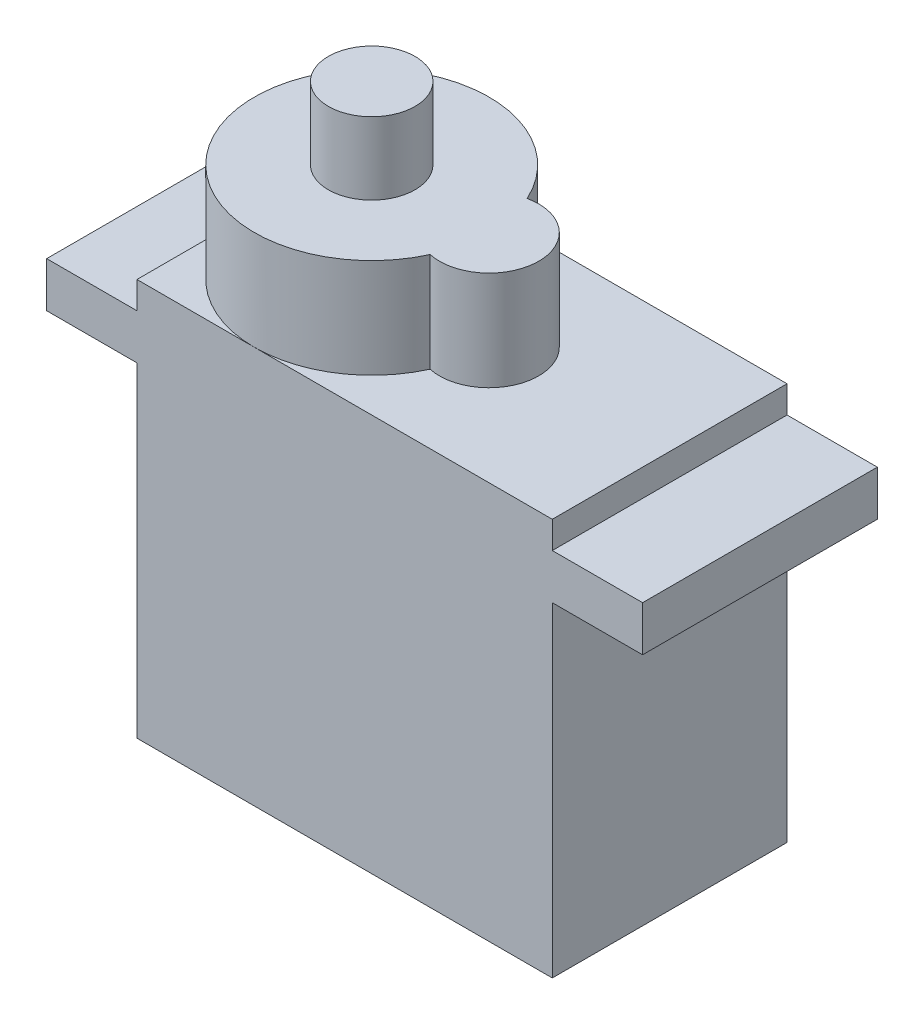
from build123d import *

# Parameters (mm, degrees)
SKETCH1_W           = 23
SKETCH1_H           = 13
BOSS_EXTRUDE1_DEPTH = 18
SKETCH2_W           = 33
SKETCH2_H           = 13
BOSS_EXTRUDE2_DEPTH = 2.5
SKETCH3_W           = 23
SKETCH3_H           = 13
BOSS_EXTRUDE3_DEPTH = 1.5
BOSS_EXTRUDE4_DEPTH = 5.5
SKETCH5_R           = 2.4
BOSS_EXTRUDE5_DEPTH = 4


with BuildPart() as part:
    # Sketch1 → Boss-Extrude1 (new body)
    with BuildSketch(Plane(origin=(0, 0, 0), x_dir=(1, 0, 0), z_dir=(0, 1, 0))):
        Rectangle(SKETCH1_W, SKETCH1_H)
    extrude(amount=BOSS_EXTRUDE1_DEPTH)

    # Sketch2 → Boss-Extrude2 (add)
    with BuildSketch(Plane(origin=(0, 18, 0), x_dir=(1, 0, 0), z_dir=(0, 1, 0))):
        Rectangle(SKETCH2_W, SKETCH2_H)
    extrude(amount=BOSS_EXTRUDE2_DEPTH)

    # Sketch3 → Boss-Extrude3 (add)
    with BuildSketch(Plane(origin=(0, 20.5, 0), x_dir=(1, 0, 0), z_dir=(0, 1, 0))):
        Rectangle(SKETCH3_W, SKETCH3_H)
    extrude(amount=BOSS_EXTRUDE3_DEPTH)

    # Sketch4 → Boss-Extrude4 (add)
    with BuildSketch(Plane(origin=(0, 22, 0), x_dir=(1, 0, 0), z_dir=(0, 1, 0))):
        with BuildLine():
            ThreePointArc((0.918269231, 2.687766603), (-11.5, 0), (0.918269231, -2.687766603))
            ThreePointArc((0.918269231, -2.687766603), (4.25, 0), (0.918269231, 2.687766603))
        make_face()
    extrude(amount=BOSS_EXTRUDE4_DEPTH)

    # Sketch5 → Boss-Extrude5 (add)
    with BuildSketch(Plane(origin=(0, 27.5, 0), x_dir=(1, 0, 0), z_dir=(0, 1, 0))):
        with Locations(Location((-5, 0, 0), (0, 0, 270))):
            Circle(SKETCH5_R)
    extrude(amount=BOSS_EXTRUDE5_DEPTH)


solid = part.part
